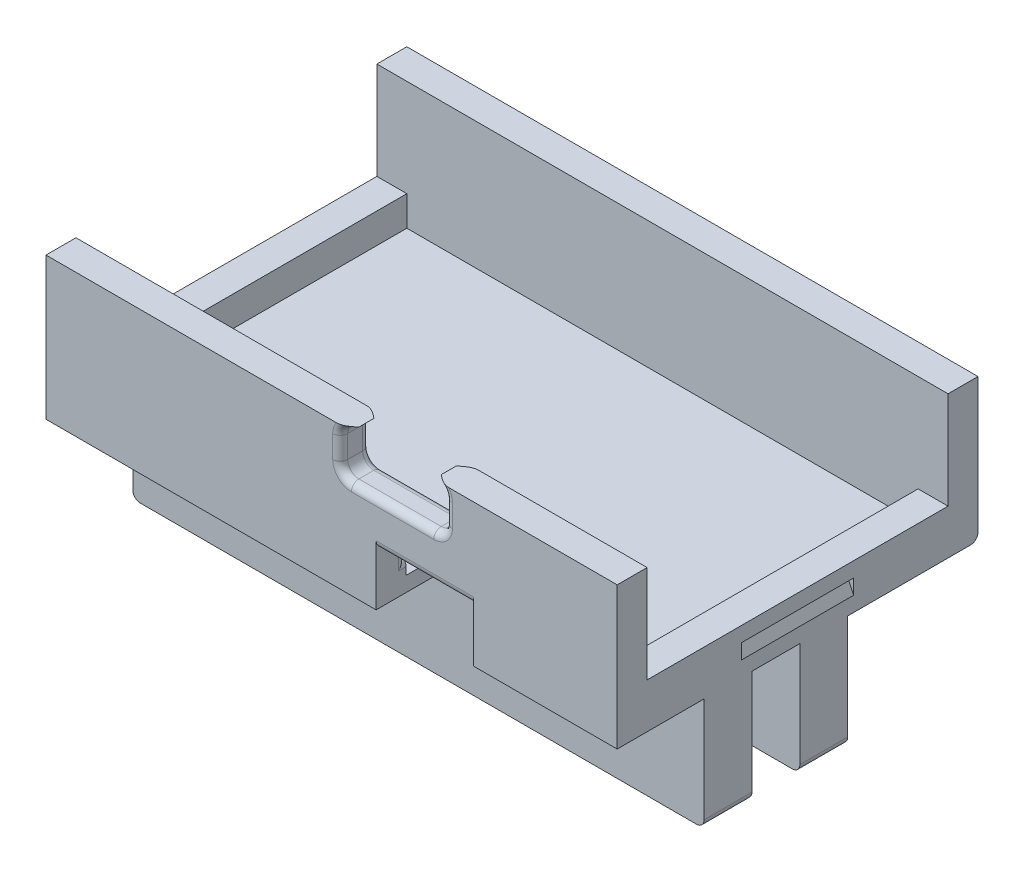
from build123d import *
from build123d.topology import SkipClean

# Parameters (mm, degrees)
SKETCH2_W               = 76.3
SKETCH2_H               = 48.2
BOSS_EXTRUDE1_DEPTH     = 4
BOSS_EXTRUDE2_DEPTH     = 15
SKETCH10_W              = 4
SKETCH10_H              = 40.2
BOSS_EXTRUDE5_DEPTH     = 2
CUT_EXTRUDE1_DEPTH      = 3
CUT_EXTRUDE1_DEPTH_BACK = 4
SKETCH5_W               = 13
SKETCH5_H               = 11.2
CUT_EXTRUDE2_REACH      = 66.34
CUT_EXTRUDE3_DEPTH      = 7.5
FILLET3_R               = 1
SKETCH17_W              = 76.3
SKETCH17_H              = 8
SKETCH17_H_2            = 6
BOSS_EXTRUDE6_DEPTH     = 15
SKETCH20_R              = 2.55
CUT_EXTRUDE5_DEPTH      = 65.340209
FILLET4_R               = 1
FILLET5_R               = 1
SKETCH21_W              = 68.3
SKETCH21_H              = 40.2
CUT_EXTRUDE6_DEPTH      = 2
SKETCH29_R              = 2.55
BOSS_EXTRUDE9_DEPTH     = 40.2
SKETCH30_W              = 17.4
SKETCH30_H              = 15
SKETCH30_W_2            = 11.6
SKETCH30_W_3            = 6.4
CUT_EXTRUDE12_DEPTH     = 83.240501


with BuildPart() as part:
    # Sketch2 → Boss-Extrude1 (new body)
    with BuildSketch(Plane(origin=(0, 0, 0), x_dir=(1, 0, 0), z_dir=(0, 1, 0))):
        Rectangle(SKETCH2_W, SKETCH2_H)
    extrude(amount=BOSS_EXTRUDE1_DEPTH)

    # Sketch3 → Boss-Extrude2 (add)
    with BuildSketch(Plane(origin=(0, 4, 0), x_dir=(1, 0, 0), z_dir=(0, 1, 0))):
        Polygon((38.15, 24.1), (-38.15, 24.1), (-38.15, 20.1), (-34.15, 20.1), (34.15, 20.1), (38.15, 20.1), align=None)
        Polygon((-38.15, -24.1), (38.15, -24.1), (38.15, -20.1), (34.15, -20.1), (-34.15, -20.1), (-38.15, -20.1), align=None)
    extrude(amount=BOSS_EXTRUDE2_DEPTH)

    # Sketch10 → Boss-Extrude5 (add)
    with BuildSketch(Plane(origin=(0, 4, 0), x_dir=(1, 0, 0), z_dir=(0, 1, 0))):
        with Locations((-36.15, 0)):
            Rectangle(SKETCH10_W, SKETCH10_H)
        with Locations((36.15, 0)):
            Rectangle(SKETCH10_W, SKETCH10_H)
    extrude(amount=BOSS_EXTRUDE5_DEPTH)

    # Sketch5 → Cut-Extrude1 (cut, two sides: drawn at the far end of the back side and taken through both)
    with BuildSketch(Plane(origin=(0, 4, 0), x_dir=(1, 0, 0), z_dir=(0, 1, 0)).offset(-CUT_EXTRUDE1_DEPTH_BACK)):
        with Locations((12.45, -18.5)):
            Rectangle(SKETCH5_W, SKETCH5_H)
    extrude(amount=CUT_EXTRUDE1_DEPTH + CUT_EXTRUDE1_DEPTH_BACK, mode=Mode.SUBTRACT)

    # Sketch8 → Cut-Extrude2 (cut, up to next)
    with BuildSketch(Plane.XY.offset(24.1), mode=Mode.PRIVATE) as cut_extrude2_sk1:
        with BuildLine():
            Line((2.65, 19), (13.65, 19))
            ThreePointArc((13.65, 19), (14.71066, 18.56066), (15.15, 17.5))
            Line((15.15, 17.5), (15.15, 14.5))
            ThreePointArc((15.15, 14.5), (14.71066, 13.43934), (13.65, 13))
            Line((13.65, 13), (2.65, 13))
            ThreePointArc((2.65, 13), (1.58934, 13.43934), (1.15, 14.5))
            Line((1.15, 14.5), (1.15, 17.5))
            ThreePointArc((1.15, 17.5), (1.58934, 18.56066), (2.65, 19))
        make_face()
    cut_extrude2_tool1 = extrude(cut_extrude2_sk1.sketch, amount=-CUT_EXTRUDE2_REACH, mode=Mode.PRIVATE) & part.part
    add(cut_extrude2_tool1.solids().sort_by_distance((8.15, 16, 24.1))[0], mode=Mode.SUBTRACT)

    # Sketch13 → Cut-Extrude3 (cut, symmetric)
    with BuildSketch(Plane.XY):
        Polygon((38.15, 4), (37.15, 4), (38.15, 2), align=None)
    cut_extrude3 = extrude(amount=CUT_EXTRUDE3_DEPTH, both=True, mode=Mode.SUBTRACT)

    # Mirror2: Cut-Extrude3 across plane
    add(cut_extrude3.mirror(Plane(origin=(0, 0, 0), x_dir=(0, 0, 1), z_dir=(1, 0, 0))), mode=Mode.SUBTRACT)

    # Fillet3
    fillet3_edges = [part.edges().sort_by_distance(p)[0] for p in [
        (0, 0, -24.1),
    ]]
    fillet(fillet3_edges, radius=FILLET3_R)

    # Sketch17 → Boss-Extrude6 (add)
    with BuildSketch(Plane.XZ):
        with Locations((0, 20.1)):
            Rectangle(SKETCH17_W, SKETCH17_H)
        with Locations((0, 6.7)):
            Rectangle(SKETCH17_W, SKETCH17_H_2)
    extrude(amount=BOSS_EXTRUDE6_DEPTH)

    # Sketch20 → Cut-Extrude5 (cut, through all)
    with BuildSketch(Plane.XY.offset(24.1)):
        with Locations((23.95, -9)):
            Circle(SKETCH20_R)
        with Locations((-23.95, -9)):
            Circle(SKETCH20_R)
    extrude(amount=-CUT_EXTRUDE5_DEPTH, mode=Mode.SUBTRACT)

    # Fillet4
    fillet4_edges = [part.edges().sort_by_distance(p)[0] for p in [
        (-38.15, -15, 20.1),
        (38.15, -15, 20.1),
        (-38.15, -15, 6.7),
        (38.15, -15, 6.7),
    ]]
    fillet(fillet4_edges, radius=FILLET4_R)

    # Fillet5
    fillet5_edges = [part.edges().sort_by_distance(p)[0] for p in [
        (1.58934, 18.56066, 24.1),
        (1.15, 16, 24.1),
        (1.58934, 13.43934, 24.1),
        (8.15, 13, 24.1),
        (14.71066, 13.43934, 24.1),
        (15.15, 16, 24.1),
        (14.71066, 18.56066, 24.1),
        (1.15, 16, 20.1),
        (1.58934, 18.56066, 20.1),
        (14.71066, 18.56066, 20.1),
        (15.15, 16, 20.1),
        (14.71066, 13.43934, 20.1),
        (8.15, 13, 20.1),
        (1.58934, 13.43934, 20.1),
        (12.45, 7, 24.1),
        (5.95, 5.5, 20.1),
        (18.95, 5.5, 20.1),
        (5.95, 4, 16.5),
        (18.95, 4, 16.5),
        (12.45, 4, 12.9),
        (12.45, 7, 20.1),
    ]]
    fillet(fillet5_edges, radius=FILLET5_R)

    # Sketch21 → Cut-Extrude6 (cut)
    with BuildSketch(Plane(origin=(0, 4, 0), x_dir=(1, 0, 0), z_dir=(0, 1, 0))):
        Rectangle(SKETCH21_W, SKETCH21_H)
    extrude(amount=-CUT_EXTRUDE6_DEPTH, mode=Mode.SUBTRACT)

    # Sketch29 → Boss-Extrude9 (add, through all)
    with SkipClean():  # the faces are left unmerged after this step: merging them gives an invalid solid
        with BuildSketch(Plane(origin=(0, 0, 16.1), x_dir=(-1, 0, 0), z_dir=(0, 0, -1))):
            with BuildLine():
                Line((-37.15, -15), (37.15, -15))
                ThreePointArc((37.15, -15), (37.857107, -14.707107), (38.15, -14))
                Line((38.15, -14), (38.15, 0))
                Line((38.15, 0), (-5.95, 0))
                Line((-5.95, 0), (-18.95, 0))
                Line((-18.95, 0), (-38.15, 0))
                Line((-38.15, 0), (-38.15, -14))
                ThreePointArc((-38.15, -14), (-37.857107, -14.707107), (-37.15, -15))
            make_face()
            with Locations(Location((-23.95, -9, 0), (0, 0, 180))):
                Circle(SKETCH29_R, mode=Mode.SUBTRACT)
            with Locations((23.95, -9)):
                Circle(SKETCH29_R, mode=Mode.SUBTRACT)
        extrude(amount=BOSS_EXTRUDE9_DEPTH)

    # Sketch30 → Cut-Extrude12 (cut, through all)
    with BuildSketch(Plane(origin=(38.15, 0, 0), x_dir=(0, 0, -1), z_dir=(1, 0, 0))):
        with Locations((15.4, -7.5)):
            Rectangle(SKETCH30_W, SKETCH30_H)
        with Locations((-18.3, -7.5)):
            Rectangle(SKETCH30_W_2, SKETCH30_H)
        with Locations((-2.9, -7.5)):
            Rectangle(SKETCH30_W_3, SKETCH30_H)
    extrude(amount=-CUT_EXTRUDE12_DEPTH, mode=Mode.SUBTRACT)


solid = part.part
